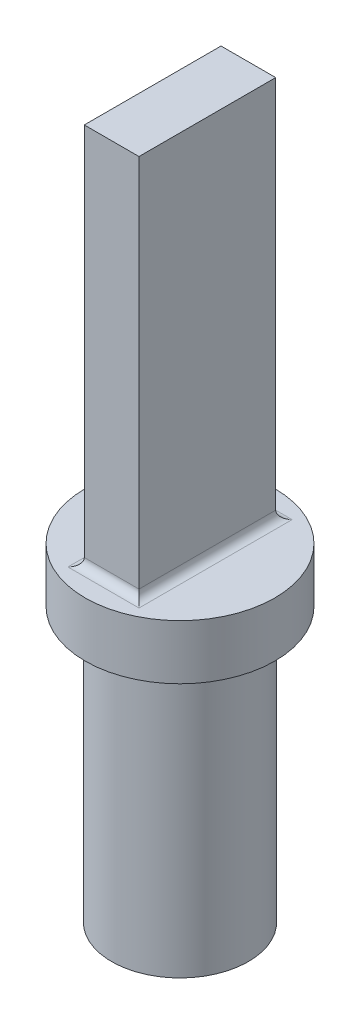
from build123d import *

# Parameters (mm, degrees)
SKETCH1_R           = 17.325
BOSS_EXTRUDE1_DEPTH = 10
SKETCH2_R           = 12.5
BOSS_EXTRUDE2_DEPTH = 50
SKETCH3_W           = 10
SKETCH3_H           = 25
BOSS_EXTRUDE3_DEPTH = 70
FILLET1_R           = 1.5


with BuildPart() as part:
    # Sketch1 → Boss-Extrude1 (new body)
    with BuildSketch(Plane(origin=(0, 0, 0), x_dir=(1, 0, 0), z_dir=(0, 1, 0))):
        with Locations(Location((0, 0, 0), (0, 0, 270))):
            Circle(SKETCH1_R)
    extrude(amount=-BOSS_EXTRUDE1_DEPTH)

    # Sketch2 → Boss-Extrude2 (add)
    with BuildSketch(Plane.XZ.offset(10)):
        with Locations(Location((0, 0, 0), (0, 0, 270))):
            Circle(SKETCH2_R)
    extrude(amount=BOSS_EXTRUDE2_DEPTH)

    # Sketch3 → Boss-Extrude3 (add)
    with BuildSketch(Plane(origin=(0, 0, 0), x_dir=(1, 0, 0), z_dir=(0, 1, 0))):
        Rectangle(SKETCH3_W, SKETCH3_H)
    extrude(amount=BOSS_EXTRUDE3_DEPTH)

    # Fillet1
    fillet1_edges = [part.edges().sort_by_distance(p)[0] for p in [
        (5, 0, 0),
        (0, 0, -12.5),
        (-5, 0, 0),
        (0, 0, 12.5),
    ]]
    fillet(fillet1_edges, radius=FILLET1_R)


solid = part.part
